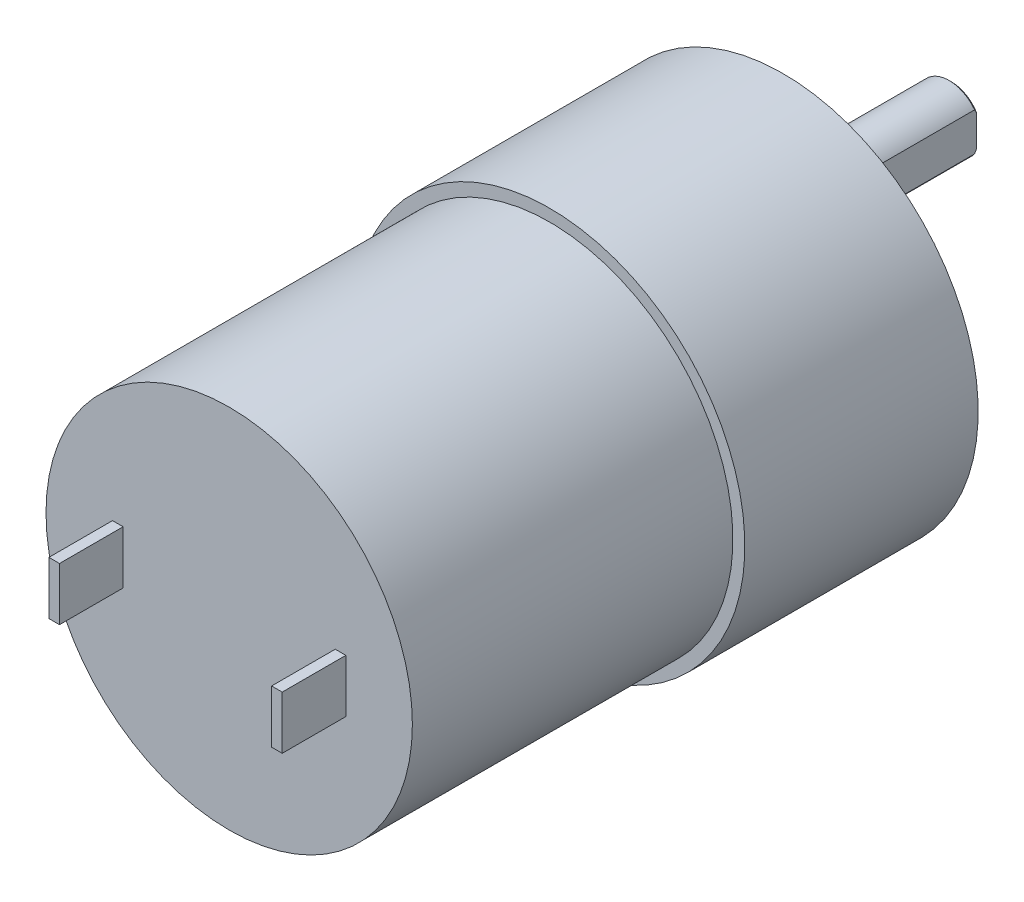
from build123d import *

# Parameters (mm, degrees)
SKETCH1_R                   = 17.272
BOSS_EXTRUDE1_DEPTH         = 52.22
SKETCH1_3_R                 = 6
BOSS_EXTRUDE2_DEPTH         = 6.5
BOSS_EXTRUDE3_DEPTH         = 22.86
BOSS_EXTRUDE4_DEPTH         = 10.668
SKETCH2_W                   = 1
SKETCH2_H                   = 5
BOSS_EXTRUDE5_DEPTH         = 6
SKETCH4_R                   = 18.4
BOSS_EXTRUDE6_DEPTH         = 22
TAP_DRILL_FOR_M3_TAP1_D     = 2.5
TAP_DRILL_FOR_M3_TAP1_DEPTH = 3
TAP_DRILL_FOR_M3_TAP1_TIP   = 0.751075774
CHAMFER1_SIZE               = 0.2
CHAMFER2_SIZE               = 0.5


with BuildPart() as part:
    # Sketch1 → Boss-Extrude1 (new body)
    with BuildSketch(Plane.XY):
        Circle(SKETCH1_R)
    extrude(amount=BOSS_EXTRUDE1_DEPTH)

    # Sketch1<3> → Boss-Extrude2 (add)
    with BuildSketch(Plane.XY):
        with Locations((-7, 0)):
            Circle(SKETCH1_3_R)
    extrude(amount=-BOSS_EXTRUDE2_DEPTH)

    # Sketch1<4> → Boss-Extrude3 (add)
    with BuildSketch(Plane.XY):
        with BuildLine():
            Line((-4.6, -1.8), (-4.6, 1.8))
            ThreePointArc((-4.6, 1.8), (-10, 0), (-4.6, -1.8))
        make_face()
    extrude(amount=-BOSS_EXTRUDE3_DEPTH)

    # Sketch1<5> → Boss-Extrude4 (add)
    with BuildSketch(Plane.XY):
        with BuildLine():
            ThreePointArc((-4.6, -1.8), (-4, 0), (-4.6, 1.8))
            Line((-4.6, 1.8), (-4.6, -1.8))
        make_face()
    extrude(amount=-BOSS_EXTRUDE4_DEPTH)

    # Sketch2 → Boss-Extrude5 (add)
    with BuildSketch(Plane.XY.offset(52.22)):
        with Locations((-10.5, 0)):
            Rectangle(SKETCH2_W, SKETCH2_H)
        with Locations((10.5, 0)):
            Rectangle(SKETCH2_W, SKETCH2_H)
    extrude(amount=BOSS_EXTRUDE5_DEPTH)

    # Sketch4 → Boss-Extrude6 (add)
    with BuildSketch(Plane(origin=(0, 0, 0), x_dir=(-1, 0, 0), z_dir=(0, 0, -1))):
        Circle(SKETCH4_R)
    extrude(amount=-BOSS_EXTRUDE6_DEPTH)

    # Tap Drill for M3 Tap1
    with Locations(Plane(origin=(0, 0, 0), x_dir=(-1, 0, 0), z_dir=(0, 0, -1))):
        with Locations((-13.423393759, -7.75), (0, -15.5), (0, 15.5), (13.423393759, 7.75), (13.423393759, -7.75), (-13.423393759, 7.75)):
            Hole(TAP_DRILL_FOR_M3_TAP1_D / 2, depth=TAP_DRILL_FOR_M3_TAP1_DEPTH)
            with Locations((0, 0, -(TAP_DRILL_FOR_M3_TAP1_DEPTH + TAP_DRILL_FOR_M3_TAP1_TIP / 2))):  # 118° drill point
                Cone(0, TAP_DRILL_FOR_M3_TAP1_D / 2, TAP_DRILL_FOR_M3_TAP1_TIP, mode=Mode.SUBTRACT)

    # Chamfer1
    chamfer1_edges = [part.edges().sort_by_distance(p)[0] for p in [
        (-10, 0, -22.86),
    ]]
    chamfer(chamfer1_edges, length=CHAMFER1_SIZE)

    # Chamfer2
    chamfer2_edges = [part.edges().sort_by_distance(p)[0] for p in [
        (-13, 0, -6.5),
    ]]
    chamfer(chamfer2_edges, length=CHAMFER2_SIZE)


solid = part.part
